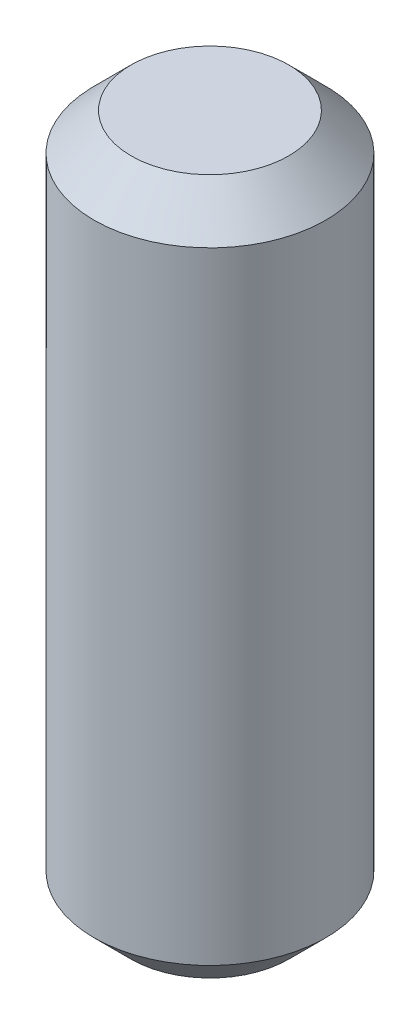
from build123d import *

# Parameters (mm, degrees)
SKETCH1_R           = 2.5
BOSS_EXTRUDE1_DEPTH = 15
CHAMFER1_SIZE       = 0.8


with BuildPart() as part:
    # Sketch1 → Boss-Extrude1 (new body)
    with BuildSketch(Plane(origin=(0, 0, 0), x_dir=(1, 0, 0), z_dir=(0, 1, 0))):
        with Locations(Location((0, 0, 0), (0, 0, 270))):
            Circle(SKETCH1_R)
    extrude(amount=BOSS_EXTRUDE1_DEPTH)

    # Chamfer1
    chamfer1_edges = [part.edges().sort_by_distance(p)[0] for p in [
        (0, 0, -2.5),
        (0, 15, -2.5),
    ]]
    chamfer(chamfer1_edges, length=CHAMFER1_SIZE)


solid = part.part
